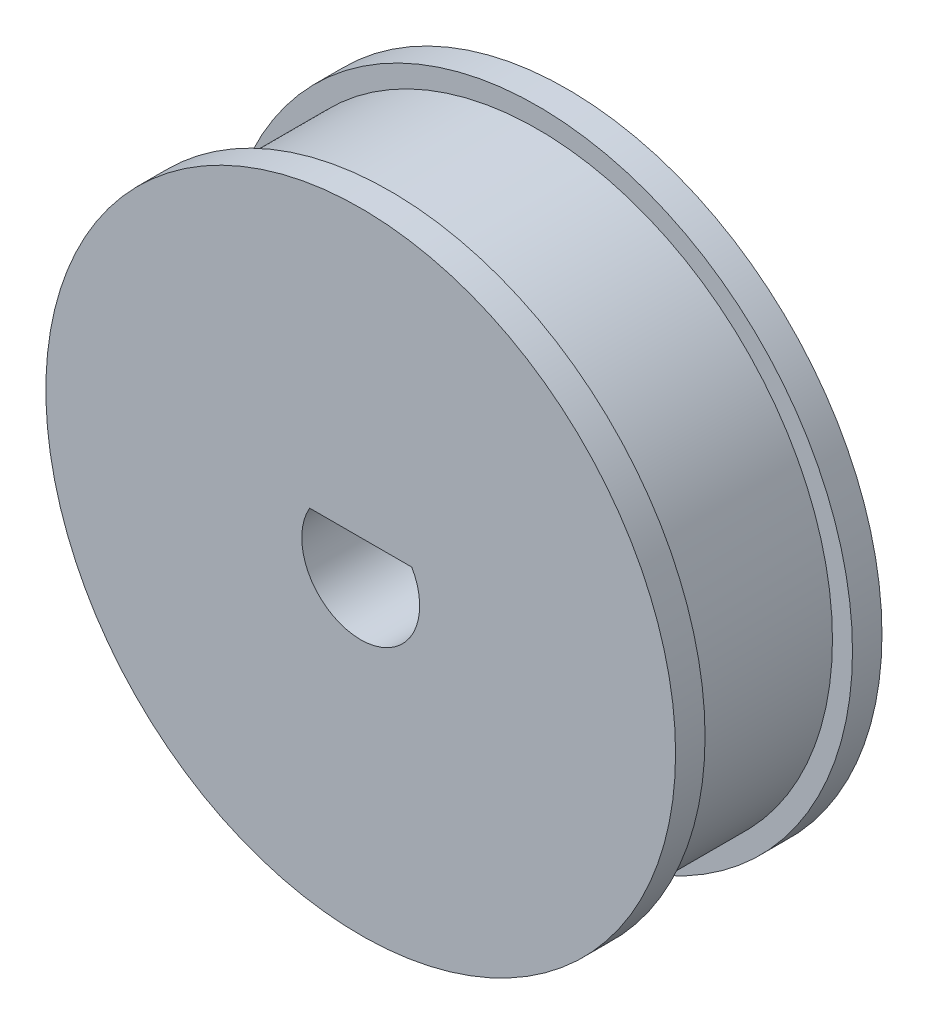
from build123d import *

# Parameters (mm, degrees)
SKETCH1_R           = 10.679205769
BOSS_EXTRUDE1_DEPTH = 7
CUT_EXTRUDE1_START  = -5
SKETCH2_R           = 10.679205769
SKETCH2_R_2         = 10
CUT_EXTRUDE1_DEPTH  = 5


with BuildPart() as part:
    # Sketch1 → Boss-Extrude1 (new body)
    with BuildSketch(Plane.XY):
        Circle(SKETCH1_R)
        with BuildLine():
            Line((-1.732050808, 1), (1.732050808, 1))
            ThreePointArc((1.732050808, 1), (0, -2), (-1.732050808, 1))
        make_face(mode=Mode.SUBTRACT)
    extrude(amount=BOSS_EXTRUDE1_DEPTH)

    # Sketch2 → Cut-Extrude1 (cut)
    with BuildSketch(Plane.XY.offset(6).offset(CUT_EXTRUDE1_START)):
        Circle(SKETCH2_R)
        Circle(SKETCH2_R_2, mode=Mode.SUBTRACT)
    extrude(amount=CUT_EXTRUDE1_DEPTH, mode=Mode.SUBTRACT)


solid = part.part
